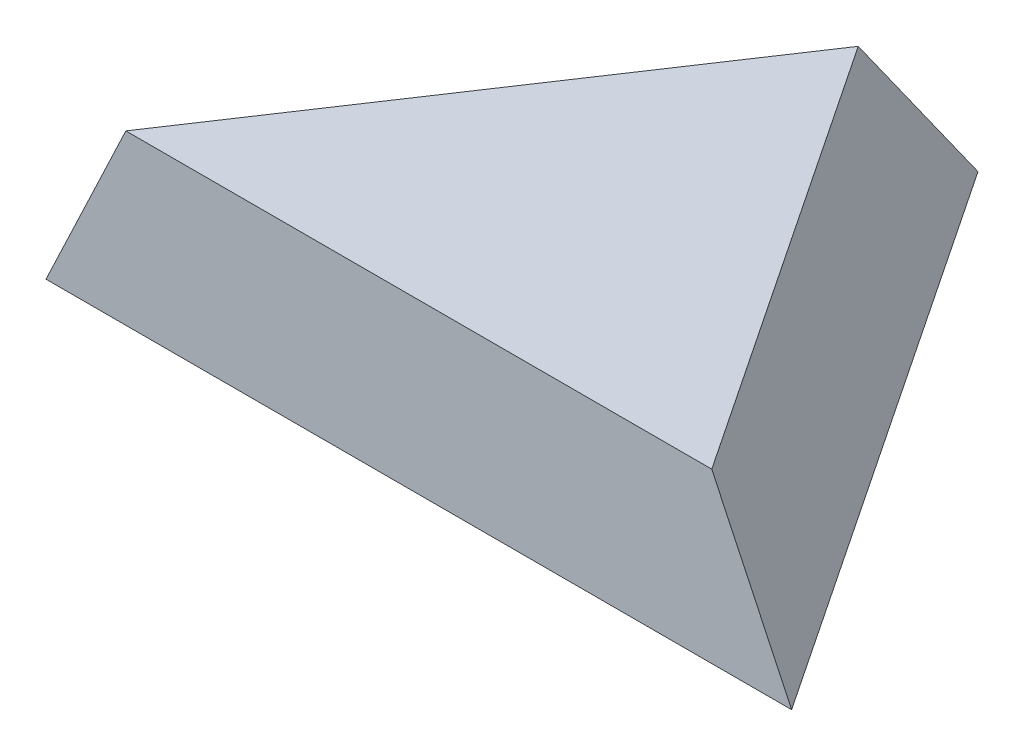
from build123d import *


with BuildPart() as part:
    # Sketch1 → Loft1 section 0
    with BuildSketch(Plane(origin=(0, 0, 0), x_dir=(1, 0, 0), z_dir=(0, 1, 0))):
        with BuildLine():
            Line((0, 0), (-304.8, -457.2))
            Line((-304.8, -457.2), (304.8, -457.2))
            Line((304.8, -457.2), (0, 0))
        make_face()
    # Sketch2 → Loft1 section 1
    with BuildSketch(Plane(origin=(0, 137.668, 0), x_dir=(1, 0, 0), z_dir=(0, 1, 0))):
        with BuildLine():
            Line((239.51954473, -457.2), (-239.51954473, -457.2))
            Line((-239.51954473, -457.2), (0, -97.920682905))
            Line((0, -97.920682905), (239.51954473, -457.2))
        make_face()
    loft()


solid = part.part
